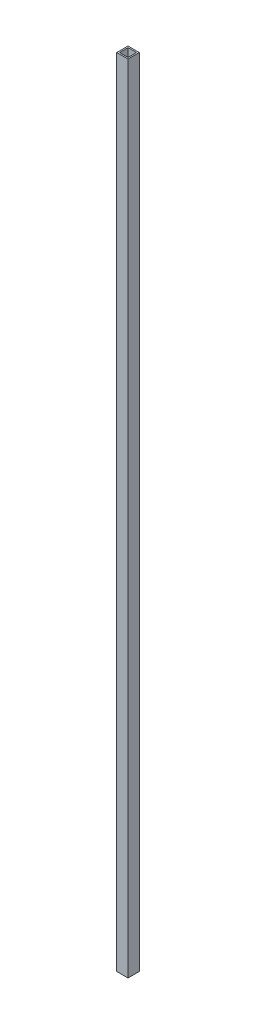
from build123d import *

# Parameters (mm, degrees)
SCHIZZO1_W                   = 40
SCHIZZO1_H                   = 40
SCHIZZO1_W_2                 = 30
SCHIZZO1_H_2                 = 30
ESTRUSIONE_ESTRUSIONE1_DEPTH = 2817


with BuildPart() as part:
    # Schizzo1 → Estrusione-Estrusione1 (new body)
    with BuildSketch(Plane(origin=(0, 0, 0), x_dir=(1, 0, 0), z_dir=(0, 1, 0))):
        Rectangle(SCHIZZO1_W, SCHIZZO1_H)
        Rectangle(SCHIZZO1_W_2, SCHIZZO1_H_2, mode=Mode.SUBTRACT)
    extrude(amount=ESTRUSIONE_ESTRUSIONE1_DEPTH)


solid = part.part
